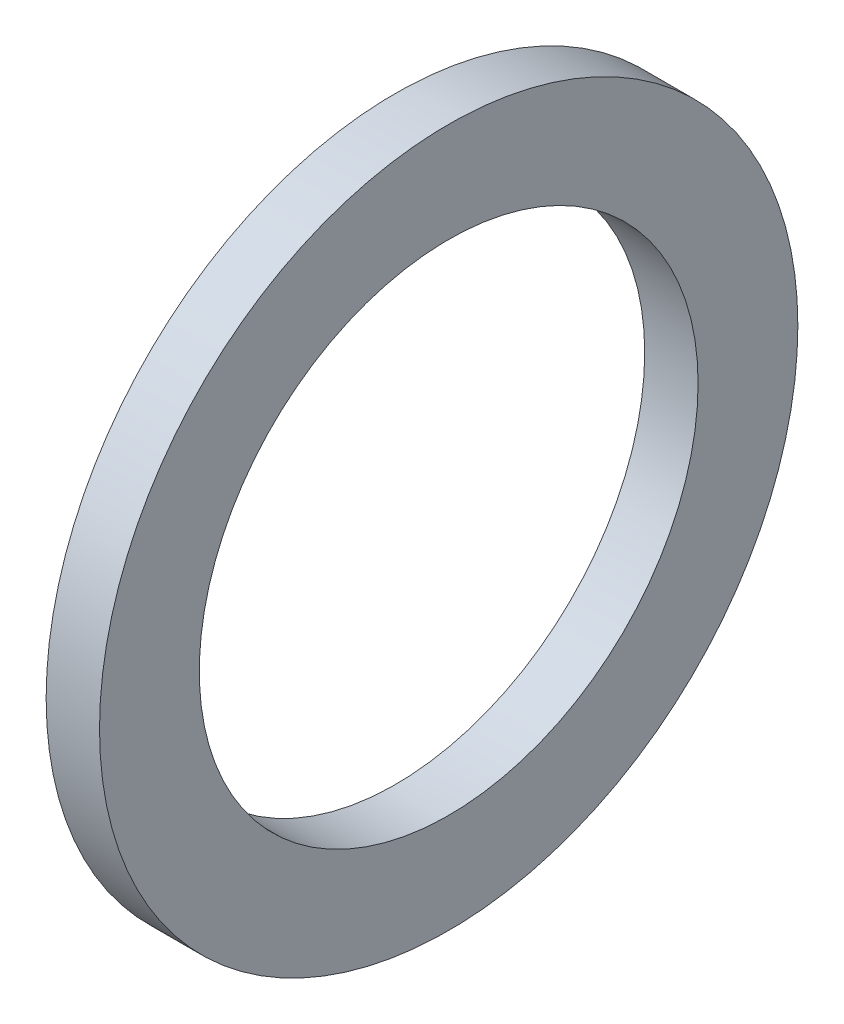
from build123d import *

# Parameters (mm, degrees)
SKETCH1_R           = 8.89
SKETCH1_R_2         = 6.35
BOSS_EXTRUDE1_DEPTH = 1.3589


with BuildPart() as part:
    # Sketch1 → Boss-Extrude1 (new body)
    with BuildSketch(Plane(origin=(0, 0, 0), x_dir=(0, 0, -1), z_dir=(1, 0, 0))):
        Circle(SKETCH1_R)
        Circle(SKETCH1_R_2, mode=Mode.SUBTRACT)
    extrude(amount=BOSS_EXTRUDE1_DEPTH)


solid = part.part
